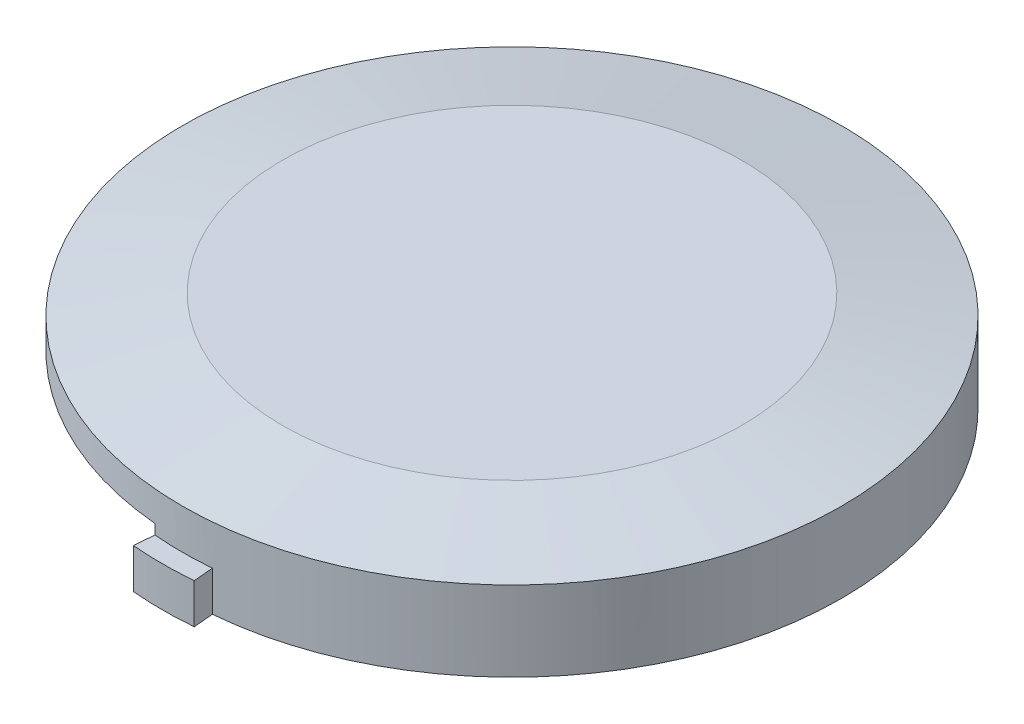
from build123d import *

# Parameters (mm, degrees)
SKETCH1_R                    = 16.5
BOSS_EXTRUDE1_DEPTH          = 5
CHAMFER2_SIZE                = 1
CHAMFER2_SIZE2               = 5
SKETCH3_R                    = 13.5
CUT_EXTRUDE1_DEPTH           = 2.8
SKETCH5_W                    = 1
SKETCH5_H                    = 2
REVOLVE4_ANGLE               = 5
REVOLVE4_OTHER_WAY_ANGLE     = 5
SKETCH6_W                    = 1
SKETCH6_H                    = 2
REVOLVE6_ANGLE               = 5
REVOLVE6_OTHER_WAY_ANGLE     = 5
SKETCH9_W                    = 16.5
SKETCH9_H                    = 2.5
CUT_REVOLVE1_ANGLE           = 85
CUT_REVOLVE1_OTHER_WAY_ANGLE = 10


with BuildPart() as part:
    # Sketch1 → Boss-Extrude1 (new body)
    with BuildSketch(Plane(origin=(0, 0, 0), x_dir=(1, 0, 0), z_dir=(0, 1, 0))):
        with Locations(Location((0, 0, 0), (0, 0, 270))):
            Circle(SKETCH1_R)
    extrude(amount=BOSS_EXTRUDE1_DEPTH)

    # Chamfer2
    chamfer2_edges = [part.edges().sort_by_distance(p)[0] for p in [
        (0, 5, -16.5),
    ]]
    chamfer2_side = [part.faces().sort_by_distance(p)[0] for p in [
        (0, 2.5, -16.5),
    ]]
    chamfer(chamfer2_edges, length=CHAMFER2_SIZE, length2=CHAMFER2_SIZE2, reference=chamfer2_side[0])

    # Sketch3 → Cut-Extrude1 (cut)
    with BuildSketch(Plane(origin=(0, 0, 0), x_dir=(1, 0, 0), z_dir=(0, 1, 0))):
        with Locations(Location((0, 0, 0), (0, 0, 270))):
            Circle(SKETCH3_R)
    extrude(amount=CUT_EXTRUDE1_DEPTH, mode=Mode.SUBTRACT)

    # Sketch5 → Revolve4 (revolve)
    with BuildSketch(Plane(origin=(0, 0, 0), x_dir=(0, 0, -1), z_dir=(1, 0, 0))):
        with Locations((17, 1)):
            Rectangle(SKETCH5_W, SKETCH5_H)
    revolve(axis=Axis((0, 0, 0), (0, 1, 0)), revolution_arc=REVOLVE4_ANGLE)

    # Sketch5 → Revolve4 other way (revolve)
    with BuildSketch(Plane(origin=(0, 0, 0), x_dir=(0, 0, -1), z_dir=(1, 0, 0))):
        with Locations((17, 1)):
            Rectangle(SKETCH5_W, SKETCH5_H)
    revolve(axis=Axis((0, 0, 0), (0, -1, 0)), revolution_arc=REVOLVE4_OTHER_WAY_ANGLE)

    # Sketch6 → Revolve6 (revolve)
    with BuildSketch(Plane(origin=(0, 0, 0), x_dir=(0, 0, -1), z_dir=(1, 0, 0))):
        with Locations((-17, 1)):
            Rectangle(SKETCH6_W, SKETCH6_H)
    revolve(axis=Axis((0, 0, 0), (0, 1, 0)), revolution_arc=REVOLVE6_ANGLE)

    # Sketch6 → Revolve6 other way (revolve)
    with BuildSketch(Plane(origin=(0, 0, 0), x_dir=(0, 0, -1), z_dir=(1, 0, 0))):
        with Locations((-17, 1)):
            Rectangle(SKETCH6_W, SKETCH6_H)
    revolve(axis=Axis((0, 0, 0), (0, -1, 0)), revolution_arc=REVOLVE6_OTHER_WAY_ANGLE)

    # Sketch9 → Cut-Revolve1 (revolve, cut)
    with BuildSketch(Plane.XY):
        with Locations((-8.25, 1.25)):
            Rectangle(SKETCH9_W, SKETCH9_H)
    revolve(axis=Axis((0, 0, 0), (0, 1, 0)), revolution_arc=CUT_REVOLVE1_ANGLE, mode=Mode.SUBTRACT)

    # Sketch9 → Cut-Revolve1 other way (revolve, cut)
    with BuildSketch(Plane.XY):
        with Locations((-8.25, 1.25)):
            Rectangle(SKETCH9_W, SKETCH9_H)
    revolve(axis=Axis((0, 0, 0), (0, -1, 0)), revolution_arc=CUT_REVOLVE1_OTHER_WAY_ANGLE, mode=Mode.SUBTRACT)


solid = part.part
